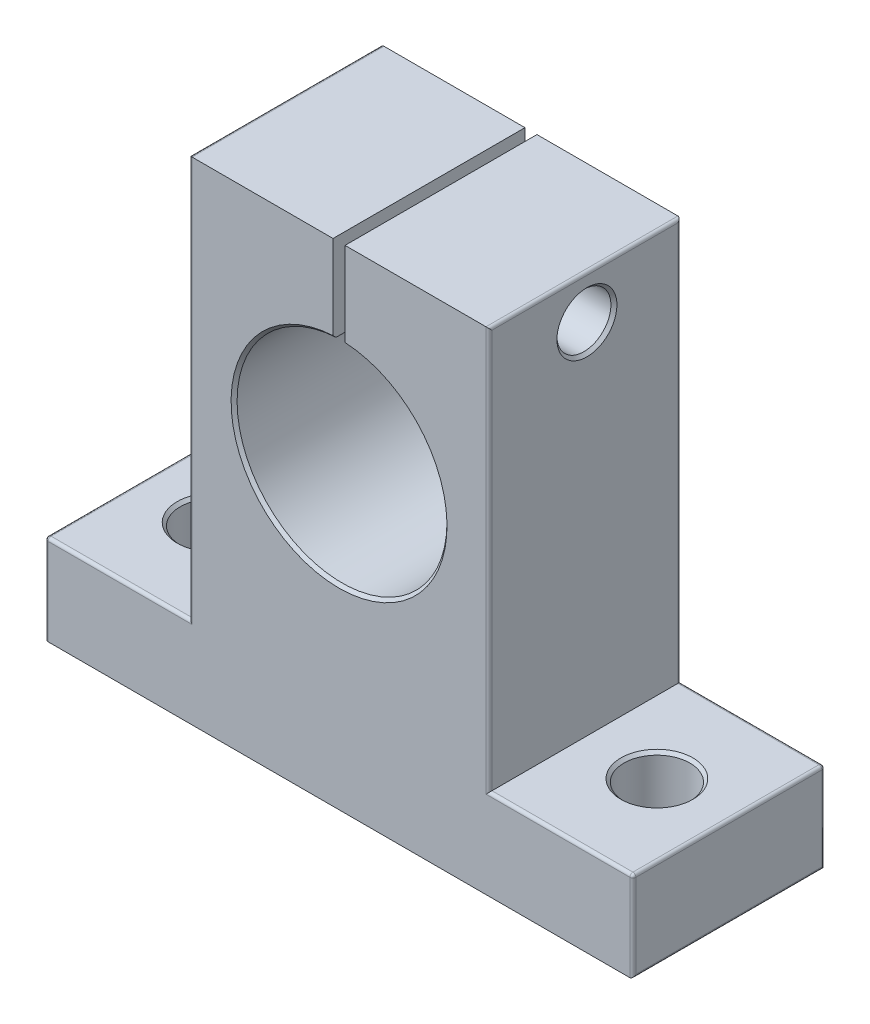
from build123d import *

# Parameters (mm, degrees)
BOSS_EXTRUDE1_DEPTH     = 16
SKETCH2_R               = 5.5
CUT_EXTRUDE1_DEPTH      = 85.534016822
CUT_EXTRUDE2_DEPTH      = 92.138630668
CUT_EXTRUDE2_DEPTH_BACK = 92.138630668
SKETCH5_R               = 4.5
CHAMFER2_SIZE           = 0.5
FILLET2_R               = 0.5


with BuildPart() as part:
    # Sketch1 → Boss-Extrude1 (new, symmetric)
    with BuildSketch(Plane.XY):
        with BuildLine():
            Line((-49, -7.5), (-49, 7.5))
            Line((-49, 7.5), (-25, 7.5))
            Line((-25, 7.5), (-25, 74.5))
            Line((-25, 74.5), (-1, 74.5))
            Line((-1, 74.5), (-1, 59.97140521))
            ThreePointArc((-1, 59.97140521), (0, 25), (1, 59.97140521))
            Line((1, 59.97140521), (1, 74.5))
            Line((1, 74.5), (25, 74.5))
            Line((25, 74.5), (25, 7.5))
            Line((25, 7.5), (49, 7.5))
            Line((49, 7.5), (49, -7.5))
            Line((49, -7.5), (-49, -7.5))
        make_face()
    extrude(amount=BOSS_EXTRUDE1_DEPTH, both=True)

    # Sketch2 → Cut-Extrude1 (cut, through all)
    with BuildSketch(Plane(origin=(0, 7.5, 0), x_dir=(1, 0, 0), z_dir=(0, 1, 0))):
        with Locations(Location((37, 0, 0), (0, 0, 180))):
            Circle(SKETCH2_R)
        with Locations((-37, 0)):
            Circle(SKETCH2_R)
    extrude(amount=-CUT_EXTRUDE1_DEPTH, mode=Mode.SUBTRACT)

    # Sketch5 → Cut-Extrude2 (cut, two sides: drawn at the far end of the back side and taken through both)
    with BuildSketch(Plane(origin=(-1, 0, 0), x_dir=(0, 0, -1), z_dir=(1, 0, 0)).offset(-CUT_EXTRUDE2_DEPTH_BACK)):
        with Locations(Location((0.330734984, 67.235702605, 0), (0, 0, 90))):
            Circle(SKETCH5_R)
    extrude(amount=CUT_EXTRUDE2_DEPTH + CUT_EXTRUDE2_DEPTH_BACK, mode=Mode.SUBTRACT)

    # Chamfer2
    chamfer2_edges = [part.edges().sort_by_distance(p)[0] for p in [
        (0, 25, -16),
        (0, 25, 16),
        (42.5, 7.5, 0),
        (-42.5, 7.5, 0),
        (-25, 62.735702605, -0.330734984),
        (25, 62.735702605, -0.330734984),
    ]]
    chamfer(chamfer2_edges, length=CHAMFER2_SIZE)

    # Fillet2
    fillet2_edges = [part.edges().sort_by_distance(p)[0] for p in [
        (-37, 7.5, 16),
        (25, 41, -16),
        (37, 7.5, -16),
        (-49, 0, 16),
        (49, 0, -16),
        (-49, 0, -16),
        (-37, 7.5, -16),
        (-25, 41, -16),
        (49, 0, 16),
        (25, 74.5, 0),
        (49, 7.5, 0),
        (49, -7.5, 0),
        (-49, -7.5, 0),
        (-49, 7.5, 0),
        (-25, 74.5, 0),
        (37, 7.5, 16),
        (25, 41, 16),
        (-25, 41, 16),
    ]]
    fillet(fillet2_edges, radius=FILLET2_R)


solid = part.part
